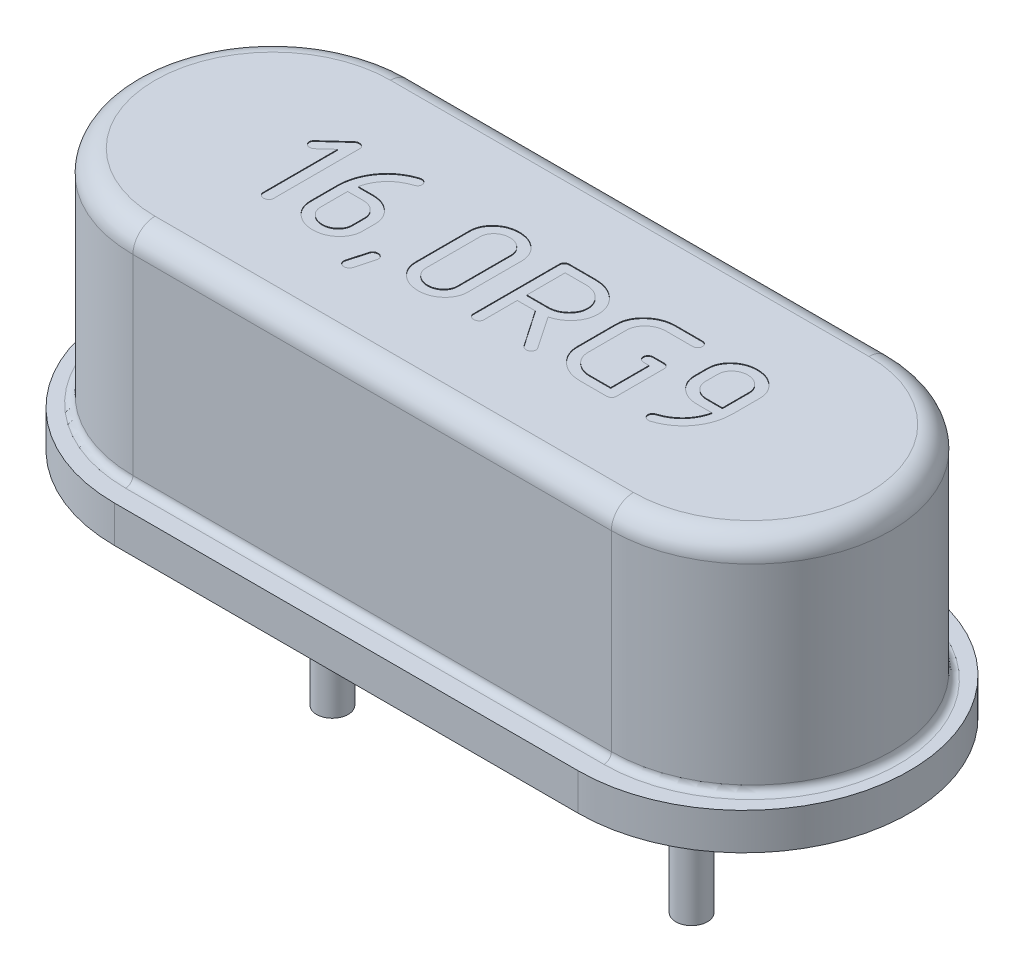
from build123d import *

# Parameters (mm, degrees)
BOSS_EXTRUDE1_START   = 0.05
BOSS_EXTRUDE1_DEPTH   = 0.5
BOSS_EXTRUDE2_DEPTH   = 3
SKETCH_3_R            = 0.645
CUT_EXTRUDE1_DEPTH    = 0.1
SKETCH_4_R            = 0.215
BOSS_EXTRUDE3_DEPTH   = 2.75
BOSS_EXTRUDE3_2_DEPTH = 2.75
CUT_EXTRUDE2_DEPTH    = 0.01
FILLET1_R             = 0.1
FILLET2_R             = 0.3


with BuildPart() as part:
    # Эскиз1 → Boss-Extrude1 (new body)
    with BuildSketch(Plane(origin=(0, 0, 0), x_dir=(1, 0, 0), z_dir=(0, 1, 0)).offset(BOSS_EXTRUDE1_START)):
        with BuildLine():
            Line((3.15, -2.25), (-3.15, -2.25))
            ThreePointArc((-3.15, -2.25), (-5.4, 0), (-3.15, 2.25))
            Line((-3.15, 2.25), (3.15, 2.25))
            ThreePointArc((3.15, 2.25), (5.4, 0), (3.15, -2.25))
        make_face()
    extrude(amount=BOSS_EXTRUDE1_DEPTH)

    # Эскиз2 → Boss-Extrude2 (add)
    with BuildSketch(Plane(origin=(0, 0.55, 0), x_dir=(1, 0, 0), z_dir=(0, 1, 0))):
        with BuildLine():
            Line((3.25, -1.9), (-3.25, -1.9))
            ThreePointArc((-3.25, -1.9), (-5.15, 0), (-3.25, 1.9))
            Line((-3.25, 1.9), (3.25, 1.9))
            ThreePointArc((3.25, 1.9), (5.15, 0), (3.25, -1.9))
        make_face()
    extrude(amount=BOSS_EXTRUDE2_DEPTH)

    # Эскиз3 → Cut-Extrude1 (cut)
    with BuildSketch(Plane.XZ.offset(-0.05)):
        with Locations(Location((2.44, 0, 0), (0, 0, 270))):
            Circle(SKETCH_3_R)
        with Locations(Location((-2.44, 0, 0), (0, 0, 90))):
            Circle(SKETCH_3_R)
    extrude(amount=-CUT_EXTRUDE1_DEPTH, mode=Mode.SUBTRACT)

    # Эскиз6 → Cut-Extrude2 (cut)
    # profile 1 of 7: a face of its own
    with BuildSketch(Plane(origin=(0, 3.55, 0), x_dir=(1, 0, 0), z_dir=(0, 1, 0))):
        with BuildLine():
            add(Edge.make_bspline(
                [(-2.725012297, 0.65), (-2.720192837, 0.649749273), (-2.710844879, 0.649262956), (-2.697498811, 0.645636223), (-2.685292044, 0.639758075), (-2.674610795, 0.631505185), (-2.665709738, 0.621597105), (-2.65863101, 0.610623967), (-2.654758447, 0.598132914), (-2.654277773, 0.589489396), (-2.654033448, 0.585095917)],
                knots=[0, 0, 0, 0, 1.080943862, 2.096628844, 3.081116141, 4.105220871, 5.104712942, 6.060880701, 7.01435038, 8, 8, 8, 8], degree=3))
            Line((-2.654033448, 0.585095917), (-2.654033448, -0.585095917))
            add(Edge.make_bspline(
                [(-2.654033448, -0.585095917), (-2.654259054, -0.58949647), (-2.654697685, -0.598052163), (-2.658795578, -0.610437613), (-2.665591859, -0.621560151), (-2.674626244, -0.631499893), (-2.685289436, -0.639746824), (-2.697587868, -0.645730006), (-2.711070628, -0.649108153), (-2.725329306, -0.650446062), (-2.739500918, -0.649151791), (-2.752842402, -0.645662614), (-2.765063152, -0.63975657), (-2.775691646, -0.631483038), (-2.784809162, -0.621655365), (-2.791167028, -0.610339272), (-2.795347744, -0.598064427), (-2.795772616, -0.589500635), (-2.795991146, -0.585095917)],
                knots=[0, 0, 0, 0, 0.985259516, 1.915572712, 2.891791621, 3.89088811, 4.914587517, 5.89868517, 6.93708688, 8.017602922, 9.098118965, 10.113401956, 11.097499609, 12.121199016, 13.120295505, 14.084427288, 15.014740484, 16, 16, 16, 16], degree=3))
            Line((-2.795991146, -0.585095917), (-2.795991146, 0.427791441))
            Line((-2.795991146, 0.427791441), (-2.959370389, 0.279439252))
            add(Edge.make_bspline(
                [(-2.959370389, 0.279439252), (-2.962997298, 0.276415595), (-2.970036901, 0.270546864), (-2.982303077, 0.264243218), (-2.995518977, 0.26074994), (-3.004645137, 0.260208899), (-3.009247418, 0.259936055)],
                knots=[0, 0, 0, 0, 1.031401964, 2.001886738, 2.992360711, 4, 4, 4, 4], degree=3))
            add(Edge.make_bspline(
                [(-3.009247418, 0.259936055), (-3.014069398, 0.260181894), (-3.023422245, 0.260658729), (-3.036826882, 0.264378467), (-3.04924131, 0.270071012), (-3.059921701, 0.278465947), (-3.069045574, 0.288277392), (-3.075401824, 0.299597614), (-3.07958295, 0.31187141), (-3.080007766, 0.320435346), (-3.080226267, 0.324840138)],
                knots=[0, 0, 0, 0, 1.079981633, 2.094762476, 3.099924327, 4.123117425, 5.121719773, 6.085374707, 7.015227781, 8, 8, 8, 8], degree=3))
            add(Edge.make_bspline(
                [(-3.080226267, 0.324840138), (-3.080020431, 0.329142687), (-3.079613788, 0.337642665), (-3.075122284, 0.349723637), (-3.068254525, 0.360914259), (-3.062035021, 0.367263214), (-3.058804722, 0.370560748)],
                knots=[0, 0, 0, 0, 0.989130722, 1.954094877, 2.937393591, 4, 4, 4, 4], degree=3))
            Line((-3.058804722, 0.370560748), (-2.774889326, 0.630496803))
            add(Edge.make_bspline(
                [(-2.774889326, 0.630496803), (-2.771269713, 0.633536288), (-2.764171229, 0.639497076), (-2.751790604, 0.645547361), (-2.73865332, 0.649239907), (-2.729619788, 0.649743265), (-2.725012297, 0.65)],
                knots=[0, 0, 0, 0, 1.03184141, 2.023561877, 2.991931391, 4, 4, 4, 4], degree=3))
        make_face()
    # profile 2 of 7: a face of its own
    with BuildSketch(Plane(origin=(0, 3.55, 0), x_dir=(1, 0, 0), z_dir=(0, 1, 0))):
        with BuildLine():
            add(Edge.make_bspline(
                [(-1.768396458, -0.594048205), (-1.777079781, -0.601715211), (-1.794280966, -0.616903129), (-1.822663664, -0.635842494), (-1.851946822, -0.652445201), (-1.882757767, -0.665978215), (-1.915184641, -0.676096022), (-1.948885073, -0.683492576), (-1.983871701, -0.687907133), (-2.019700004, -0.689564027), (-2.055527991, -0.687906826), (-2.090515535, -0.683493753), (-2.124212714, -0.676091741), (-2.15665145, -0.665993882), (-2.187504091, -0.652349798), (-2.217025792, -0.635964454), (-2.245353434, -0.616807432), (-2.27153259, -0.594441644), (-2.29573571, -0.570409813), (-2.317048688, -0.544842273), (-2.334630394, -0.517644461), (-2.349628795, -0.489555838), (-2.360669609, -0.459793377), (-2.369154984, -0.429142789), (-2.374024846, -0.397040181), (-2.374613728, -0.375266024), (-2.37491392, -0.364166257)],
                knots=[0, 0, 0, 0, 1.027880341, 2.036174347, 3.023722854, 4.015708177, 5.018699673, 6.036283645, 7.076643558, 8.147440813, 9.218238069, 10.258597981, 11.276181953, 12.27917345, 13.271158772, 14.266976344, 15.275270349, 16.30315069, 17.320646587, 18.302461157, 19.252969392, 20.193001166, 21.124845898, 22.066401843, 23.014313636, 24, 24, 24, 24], degree=3))
            Line((-2.37491392, -0.364166257), (-2.37491392, 0))
            add(Edge.make_bspline(
                [(-2.37491392, 0), (-2.374545053, 0.017918871), (-2.373814171, 0.053423804), (-2.367979402, 0.106049847), (-2.35799793, 0.157333198), (-2.344246311, 0.207374943), (-2.326511368, 0.256186943), (-2.305169193, 0.303816905), (-2.27968104, 0.350194827), (-2.250375449, 0.394873394), (-2.21809886, 0.437771122), (-2.181898961, 0.477216783), (-2.143036656, 0.51376185), (-2.100770855, 0.546698821), (-2.056079603, 0.576945454), (-2.008071093, 0.60347889), (-1.95714331, 0.627050651), (-1.921442226, 0.639728155), (-1.903320216, 0.646163305)],
                knots=[0, 0, 0, 0, 1.004229544, 1.989807487, 2.963381842, 3.930040632, 4.895665206, 5.871600899, 6.852769725, 7.858508388, 8.864513131, 9.858258314, 10.855713287, 11.851198595, 12.858550397, 13.877420399, 14.922570291, 16, 16, 16, 16], degree=3))
            add(Edge.make_bspline(
                [(-1.903320216, 0.646163305), (-1.899081065, 0.647282303), (-1.89069454, 0.649496071), (-1.882028068, 0.649833254), (-1.877742253, 0.65)],
                knots=[0, 0, 0, 0, 1.01094356, 2, 2, 2, 2], degree=3))
            add(Edge.make_bspline(
                [(-1.877742253, 0.65), (-1.872922793, 0.649749273), (-1.863574835, 0.649262956), (-1.850228767, 0.645636223), (-1.838021999, 0.639758075), (-1.827340751, 0.631505185), (-1.818439694, 0.621597105), (-1.811360966, 0.610623967), (-1.807488403, 0.598132914), (-1.807007729, 0.589489396), (-1.806763404, 0.585095917)],
                knots=[0, 0, 0, 0, 1.080943862, 2.096628844, 3.081116141, 4.105220871, 5.104712942, 6.060880701, 7.01435038, 8, 8, 8, 8], degree=3))
            add(Edge.make_bspline(
                [(-1.806763404, 0.585095917), (-1.807150156, 0.577909216), (-1.807887688, 0.564204259), (-1.818371915, 0.546128776), (-1.834005097, 0.531562961), (-1.847734034, 0.526437197), (-1.85504181, 0.523708805)],
                knots=[0, 0, 0, 0, 1.012219468, 1.930290753, 2.898314459, 4, 4, 4, 4], degree=3))
            add(Edge.make_bspline(
                [(-1.85504181, 0.523708805), (-1.878541217, 0.515150898), (-1.924656529, 0.498356834), (-1.988271567, 0.463161238), (-2.045995237, 0.421906755), (-2.096035904, 0.373031112), (-2.13903112, 0.31897774), (-2.174197798, 0.26020145), (-2.201614176, 0.19712356), (-2.21288287, 0.152595186), (-2.218568618, 0.13012789)],
                knots=[0, 0, 0, 0, 1.067365666, 2.094601819, 3.095831916, 4.091118831, 5.073440703, 6.039665875, 7.010891187, 8, 8, 8, 8], degree=3))
            Line((-2.218568618, 0.13012789), (-2.019699951, 0.13012789))
            add(Edge.make_bspline(
                [(-2.019699951, 0.13012789), (-2.007642975, 0.129806686), (-1.983871743, 0.129173409), (-1.94888496, 0.124576775), (-1.915185042, 0.11722687), (-1.882756303, 0.107098688), (-1.851952212, 0.093561674), (-1.822643464, 0.076985183), (-1.794358766, 0.057942331), (-1.768189018, 0.035559555), (-1.743983426, 0.011532226), (-1.722671, -0.014036457), (-1.705089442, -0.041234016), (-1.690089946, -0.06932256), (-1.679053338, -0.09908558), (-1.670523849, -0.129835676), (-1.66571818, -0.162055541), (-1.665112815, -0.183933184), (-1.664805706, -0.195031972)],
                knots=[0, 0, 0, 0, 1.08068204, 2.130645763, 3.157623296, 4.169873646, 5.171016222, 6.167681025, 7.185282833, 8.222651783, 9.249540426, 10.240418362, 11.199700964, 12.148410397, 13.088857209, 14.039104882, 15.00521453, 16, 16, 16, 16], degree=3))
            Line((-1.664805706, -0.195031972), (-1.664805706, -0.364166257))
            add(Edge.make_bspline(
                [(-1.664805706, -0.364166257), (-1.66510589, -0.375266033), (-1.665694755, -0.397040208), (-1.670564738, -0.429142687), (-1.67904966, -0.459793757), (-1.690092155, -0.489554431), (-1.70508422, -0.517649792), (-1.722690136, -0.544821857), (-1.743908523, -0.57048999), (-1.760137269, -0.586102588), (-1.768396458, -0.594048205)],
                knots=[0, 0, 0, 0, 1.024508938, 2.009755503, 2.988395887, 3.956942568, 4.933998749, 5.92194402, 6.942428669, 8, 8, 8, 8], degree=3))
        make_face()
        with BuildLine():
            add(Edge.make_bspline(
                [(-2.170609936, -0.501967536), (-2.159957967, -0.510771998), (-2.138944829, -0.528140559), (-2.101806299, -0.545548122), (-2.062085805, -0.556908067), (-2.02001078, -0.559906144), (-1.977885333, -0.556835688), (-1.938013965, -0.545752311), (-1.901239673, -0.527813087), (-1.868808534, -0.502946101), (-1.841283702, -0.473426417), (-1.821267661, -0.439648282), (-1.808804297, -0.40285439), (-1.807448756, -0.377158116), (-1.806763404, -0.364166257)],
                knots=[0, 0, 0, 0, 1.021602171, 2.015314498, 3.016735725, 4.071964365, 5.127193006, 6.13623326, 7.122842026, 8.144444197, 9.151841138, 10.098378379, 11.038553163, 12, 12, 12, 12], degree=3))
            Line((-1.806763404, -0.364166257), (-1.806763404, -0.195031972))
            add(Edge.make_bspline(
                [(-1.806763404, -0.195031972), (-1.807448577, -0.182039871), (-1.808803764, -0.156343119), (-1.821269746, -0.119552762), (-1.841275607, -0.08576088), (-1.868782824, -0.056358435), (-1.901092429, -0.031232832), (-1.937781201, -0.013276815), (-1.977659003, -0.00174638), (-2.005443992, -0.000592192), (-2.019699951, 0)],
                knots=[0, 0, 0, 0, 0.970580775, 1.919687408, 2.875216942, 3.892184356, 4.917139854, 5.923811547, 6.934746476, 8, 8, 8, 8], degree=3))
            Line((-2.019699951, 0), (-2.232956222, 0))
            Line((-2.232956222, 0), (-2.232956222, -0.364166257))
            add(Edge.make_bspline(
                [(-2.232956222, -0.364166257), (-2.23227414, -0.37716193), (-2.230925067, -0.402865747), (-2.218413907, -0.439603898), (-2.19862019, -0.473536305), (-2.180122428, -0.492312077), (-2.170609936, -0.501967536)],
                knots=[0, 0, 0, 0, 0.998844728, 1.975589973, 2.958945159, 4, 4, 4, 4], degree=3))
        make_face(mode=Mode.SUBTRACT)
    # profile 3 of 7: a face of its own
    with BuildSketch(Plane(origin=(0, 3.55, 0), x_dir=(1, 0, 0), z_dir=(0, 1, 0))):
        with BuildLine():
            add(Edge.make_bspline(
                [(-1.301278898, -0.51987211), (-1.296462135, -0.520134526), (-1.287016348, -0.520649128), (-1.273536632, -0.524171542), (-1.261230097, -0.530113724), (-1.250596995, -0.538388937), (-1.241489846, -0.548218981), (-1.235046543, -0.559613492), (-1.230989418, -0.572037809), (-1.230532367, -0.580695324), (-1.230300049, -0.585095917)],
                knots=[0, 0, 0, 0, 1.076707874, 2.111449841, 3.092079142, 4.112170624, 5.107745899, 6.068479697, 7.018212931, 8, 8, 8, 8], degree=3))
            add(Edge.make_bspline(
                [(-1.230300049, -0.585095917), (-1.230308945, -0.588089054), (-1.230324263, -0.593242686), (-1.23120833, -0.598315909), (-1.231578947, -0.600442696)],
                knots=[0, 0, 0, 0, 1.161563942, 2, 2, 2, 2], degree=3))
            Line((-1.231578947, -0.600442696), (-1.302557796, -0.860698475))
            add(Edge.make_bspline(
                [(-1.302557796, -0.860698475), (-1.305209897, -0.867377909), (-1.310704346, -0.881215925), (-1.32772872, -0.896754205), (-1.348580011, -0.908024153), (-1.364331997, -0.909296076), (-1.372257747, -0.909936055)],
                knots=[0, 0, 0, 0, 0.936021192, 1.939187544, 2.963084071, 4, 4, 4, 4], degree=3))
            add(Edge.make_bspline(
                [(-1.372257747, -0.909936055), (-1.377079727, -0.909690216), (-1.386432575, -0.909213381), (-1.399837212, -0.905493643), (-1.412251639, -0.899801099), (-1.422932031, -0.891406163), (-1.432055904, -0.881594718), (-1.438412153, -0.870274496), (-1.442593279, -0.858000701), (-1.443018095, -0.849436765), (-1.443236596, -0.845031972)],
                knots=[0, 0, 0, 0, 1.079981633, 2.094762476, 3.099924327, 4.123117425, 5.121719773, 6.085374707, 7.015227781, 8, 8, 8, 8], degree=3))
            add(Edge.make_bspline(
                [(-1.443236596, -0.845031972), (-1.443276805, -0.841924208), (-1.443345277, -0.836632011), (-1.442136793, -0.831488521), (-1.441637973, -0.82936547)],
                knots=[0, 0, 0, 0, 1.174470349, 2, 2, 2, 2], degree=3))
            Line((-1.441637973, -0.82936547), (-1.370659124, -0.569429415))
            add(Edge.make_bspline(
                [(-1.370659124, -0.569429415), (-1.368133861, -0.562738125), (-1.362884647, -0.548829079), (-1.345647808, -0.533339798), (-1.324899213, -0.521819064), (-1.309101948, -0.520516941), (-1.301278898, -0.51987211)],
                knots=[0, 0, 0, 0, 0.930230329, 1.933650631, 2.976711917, 4, 4, 4, 4], degree=3))
        make_face()
    # profile 4 of 7: a face of its own
    with BuildSketch(Plane(origin=(0, 3.55, 0), x_dir=(1, 0, 0), z_dir=(0, 1, 0))):
        with BuildLine():
            add(Edge.make_bspline(
                [(-0.838957206, 0.594048205), (-0.830271562, 0.601711044), (-0.81306578, 0.616890707), (-0.784639303, 0.635942624), (-0.755143575, 0.652355589), (-0.724284014, 0.665992314), (-0.691847156, 0.67609217), (-0.658149461, 0.683493635), (-0.623162062, 0.687906857), (-0.587334026, 0.689564027), (-0.551505772, 0.687907103), (-0.516519001, 0.683492693), (-0.482819079, 0.676095599), (-0.450390341, 0.665979764), (-0.41958625, 0.652439496), (-0.390277503, 0.635863874), (-0.361992804, 0.616820784), (-0.335823056, 0.594438074), (-0.311617464, 0.570410727), (-0.290305038, 0.544842049), (-0.27272348, 0.517644489), (-0.257723984, 0.489555945), (-0.246687376, 0.459792924), (-0.238157888, 0.429042829), (-0.233352219, 0.396822963), (-0.232746853, 0.374945321), (-0.232439744, 0.363846532)],
                knots=[0, 0, 0, 0, 1.02747958, 2.03538046, 3.030809771, 4.022408327, 5.025008766, 6.042195991, 7.082150276, 8.152530037, 9.222909798, 10.262864083, 11.280051308, 12.282651747, 13.274250303, 14.261413773, 15.269314654, 16.296794233, 17.313893417, 18.295325187, 19.245462826, 20.185128091, 21.116609504, 22.057798345, 23.014697947, 24, 24, 24, 24], degree=3))
            Line((-0.232439744, 0.363846532), (-0.232439744, -0.364166257))
            add(Edge.make_bspline(
                [(-0.232439744, -0.364166257), (-0.232739937, -0.375266024), (-0.233328818, -0.397040181), (-0.238198681, -0.429142788), (-0.246684053, -0.459793381), (-0.257724879, -0.489555822), (-0.272723237, -0.517644522), (-0.290305106, -0.54484204), (-0.311617445, -0.57041073), (-0.335823061, -0.594438073), (-0.361992803, -0.616820784), (-0.390277503, -0.635863874), (-0.41958625, -0.652439496), (-0.450390341, -0.665979764), (-0.482819079, -0.676095599), (-0.516519001, -0.683492693), (-0.55150577, -0.687907101), (-0.587334034, -0.689564036), (-0.623162031, -0.687906824), (-0.658149573, -0.683493753), (-0.691846753, -0.676091741), (-0.724285488, -0.665993882), (-0.755138129, -0.652349798), (-0.78465983, -0.635964454), (-0.812987472, -0.616807432), (-0.839166628, -0.594441644), (-0.863369748, -0.570409813), (-0.884682727, -0.544842273), (-0.902264432, -0.517644461), (-0.917262833, -0.489555838), (-0.928303647, -0.459793377), (-0.936789023, -0.429142789), (-0.941658885, -0.397040181), (-0.942247766, -0.375266024), (-0.942547959, -0.364166257)],
                knots=[0, 0, 0, 0, 0.995113531, 1.952091213, 2.90265226, 3.843409214, 4.792431512, 5.752030468, 6.743235176, 7.770462468, 8.808173522, 9.826110916, 10.823104401, 11.824577134, 12.837161305, 13.864477515, 14.914787496, 15.995825925, 17.076864354, 18.127174335, 19.154490545, 20.167074716, 21.168547449, 22.173889084, 23.191826478, 24.229537532, 25.256764824, 26.247969532, 27.207568488, 28.156590786, 29.09734774, 30.047908787, 31.004886469, 32, 32, 32, 32], degree=3))
            Line((-0.942547959, -0.364166257), (-0.942547959, 0.363846532))
            add(Edge.make_bspline(
                [(-0.942547959, 0.363846532), (-0.942240858, 0.37494533), (-0.941635509, 0.39682299), (-0.936829718, 0.429042726), (-0.928300681, 0.4597933), (-0.917262405, 0.489554554), (-0.902269201, 0.517649758), (-0.884663597, 0.544821867), (-0.863445124, 0.570489987), (-0.847216389, 0.586102587), (-0.838957206, 0.594048205)],
                knots=[0, 0, 0, 0, 1.023264426, 2.017032092, 2.994483682, 3.961853831, 4.937723143, 5.924468317, 6.943713343, 8, 8, 8, 8], degree=3))
        make_face()
        with BuildLine():
            add(Edge.make_bspline(
                [(-0.437063453, 0.501647811), (-0.447737752, 0.510405895), (-0.4687574, 0.527652164), (-0.505611326, 0.545771302), (-0.545514851, 0.556823812), (-0.587653558, 0.559920657), (-0.629690266, 0.556863306), (-0.669589115, 0.545690465), (-0.706274897, 0.527513289), (-0.738883404, 0.502746459), (-0.766048563, 0.472989538), (-0.786101022, 0.439342766), (-0.798545524, 0.402531029), (-0.799903618, 0.376837171), (-0.800590261, 0.363846532)],
                knots=[0, 0, 0, 0, 1.021459491, 2.011440767, 3.020340095, 4.075421359, 5.130502623, 6.131783988, 7.128842827, 8.150302318, 9.152238921, 10.098643965, 11.038687442, 12, 12, 12, 12], degree=3))
            Line((-0.800590261, 0.363846532), (-0.800590261, -0.364166257))
            add(Edge.make_bspline(
                [(-0.800590261, -0.364166257), (-0.79990369, -0.377157041), (-0.798545739, -0.402851189), (-0.786100183, -0.43966079), (-0.766051813, -0.473315854), (-0.738870373, -0.50303975), (-0.706361545, -0.527903875), (-0.669498284, -0.545611231), (-0.62970333, -0.556890083), (-0.587649348, -0.559911076), (-0.545518216, -0.55683443), (-0.505648299, -0.545752633), (-0.46887363, -0.527812998), (-0.436442594, -0.502946125), (-0.408917735, -0.473426411), (-0.388901701, -0.439648283), (-0.376438335, -0.402854389), (-0.375082794, -0.377158116), (-0.374397442, -0.364166257)],
                knots=[0, 0, 0, 0, 0.970531288, 1.919589529, 2.875070344, 3.88661525, 4.917870263, 5.920971909, 6.931855293, 7.997054504, 9.062253714, 10.080828116, 11.076759081, 12.108014095, 13.124929656, 14.080410471, 15.029468712, 16, 16, 16, 16], degree=3))
            Line((-0.374397442, -0.364166257), (-0.374397442, 0.363846532))
            add(Edge.make_bspline(
                [(-0.374397442, 0.363846532), (-0.375078634, 0.376843024), (-0.376425947, 0.402548459), (-0.388950112, 0.439274652), (-0.408729711, 0.473316056), (-0.427424772, 0.492009806), (-0.437063453, 0.501647811)],
                knots=[0, 0, 0, 0, 0.997466395, 1.972863803, 2.954862031, 4, 4, 4, 4], degree=3))
        make_face(mode=Mode.SUBTRACT)
    # profile 5 of 7: a face of its own
    with BuildSketch(Plane(origin=(0, 3.55, 0), x_dir=(1, 0, 0), z_dir=(0, 1, 0))):
        with BuildLine():
            Line((0.131087063, 0.65), (0.486301033, 0.65))
            add(Edge.make_bspline(
                [(0.486301033, 0.65), (0.500700555, 0.649576973), (0.529162898, 0.648740811), (0.571068389, 0.643750416), (0.611265329, 0.634631603), (0.649926311, 0.622286505), (0.686736539, 0.605615102), (0.722470108, 0.586355542), (0.75610654, 0.562683853), (0.787831766, 0.536003697), (0.8169696, 0.507028947), (0.8425118, 0.476108145), (0.863972013, 0.443707814), (0.881880425, 0.40983422), (0.895459577, 0.374356546), (0.905608237, 0.337564666), (0.911409706, 0.299234879), (0.912128753, 0.27317039), (0.912493851, 0.259936055)],
                knots=[0, 0, 0, 0, 1.076669153, 2.128162837, 3.148775729, 4.154097676, 5.156415777, 6.165550729, 7.18445173, 8.224991266, 9.261618985, 10.252183112, 11.217857894, 12.162262626, 13.110691828, 14.051965761, 15.01087884, 16, 16, 16, 16], degree=3))
            add(Edge.make_bspline(
                [(0.912493851, 0.259936055), (0.912278888, 0.249051064), (0.911851567, 0.227412981), (0.907498591, 0.195548629), (0.900845727, 0.164482692), (0.891166357, 0.134454257), (0.878977582, 0.105255611), (0.864232287, 0.076938262), (0.846542065, 0.049664132), (0.826143827, 0.023722107), (0.803826016, -0.000871963), (0.779890427, -0.023537478), (0.754402312, -0.044252634), (0.727305967, -0.062686924), (0.698764771, -0.079038574), (0.668780879, -0.093289446), (0.637148938, -0.105022454), (0.615299965, -0.111296681), (0.60427939, -0.114461387)],
                knots=[0, 0, 0, 0, 0.999751351, 1.987388152, 2.949840543, 3.916221633, 4.882056646, 5.854572294, 6.846134746, 7.864894479, 8.884077822, 9.895561618, 10.891323273, 11.899149404, 12.903782056, 13.911417815, 14.946523579, 16, 16, 16, 16], degree=3))
            Line((0.60427939, -0.114461387), (0.900983768, -0.551205116))
            add(Edge.make_bspline(
                [(0.900983768, -0.551205116), (0.904338296, -0.556695673), (0.91072463, -0.567148571), (0.911924319, -0.579318463), (0.912493851, -0.585095917)],
                knots=[0, 0, 0, 0, 1.050533193, 2, 2, 2, 2], degree=3))
            add(Edge.make_bspline(
                [(0.912493851, -0.585095917), (0.912268248, -0.58949649), (0.911829622, -0.598052224), (0.907731696, -0.61043738), (0.900935543, -0.621561081), (0.89190066, -0.631496298), (0.881239354, -0.639760373), (0.869027378, -0.6456356), (0.855682723, -0.649263125), (0.846334565, -0.649749331), (0.841515002, -0.65)],
                knots=[0, 0, 0, 0, 0.985939296, 1.916894362, 2.893786813, 3.893572629, 4.917978338, 5.902754969, 6.918738455, 8, 8, 8, 8], degree=3))
            add(Edge.make_bspline(
                [(0.841515002, -0.65), (0.835373061, -0.649705618), (0.823499241, -0.649136509), (0.80711644, -0.642598388), (0.792563888, -0.63277712), (0.785432535, -0.623492189), (0.781726513, -0.618666995)],
                knots=[0, 0, 0, 0, 1.042271553, 2.014956347, 2.968412152, 4, 4, 4, 4], degree=3))
            Line((0.781726513, -0.618666995), (0.446655189, -0.13012789))
            Line((0.446655189, -0.13012789), (0.202065912, -0.13012789))
            Line((0.202065912, -0.13012789), (0.202065912, -0.585095917))
            add(Edge.make_bspline(
                [(0.202065912, -0.585095917), (0.20184738, -0.589500626), (0.201422503, -0.598064401), (0.197241822, -0.610339369), (0.190883822, -0.621654979), (0.18176683, -0.631484554), (0.171136343, -0.639750858), (0.158829462, -0.645728636), (0.145348494, -0.649109532), (0.131091587, -0.650441839), (0.116911105, -0.649166833), (0.103507891, -0.645586092), (0.091093092, -0.639857278), (0.080412801, -0.631472151), (0.071288902, -0.621658142), (0.064932659, -0.610338572), (0.060751531, -0.598064611), (0.060326715, -0.589500698), (0.060108214, -0.585095917)],
                knots=[0, 0, 0, 0, 0.984676436, 1.91443907, 2.878000276, 3.876505497, 4.899599075, 5.883114336, 6.920901516, 8.000778106, 9.080654696, 10.095336839, 11.100400925, 12.123494503, 13.121999724, 14.08556093, 15.015323564, 16, 16, 16, 16], degree=3))
            Line((0.060108214, -0.585095917), (0.060108214, 0.585095917))
            add(Edge.make_bspline(
                [(0.060108214, 0.585095917), (0.060345372, 0.589493786), (0.060811943, 0.598145941), (0.064770759, 0.610520753), (0.071407334, 0.621697257), (0.080397203, 0.631478394), (0.091097302, 0.639862846), (0.103506496, 0.645558174), (0.116912534, 0.649277167), (0.126265184, 0.649754107), (0.131087063, 0.65)],
                knots=[0, 0, 0, 0, 0.984515408, 1.936887906, 2.879615877, 3.877957807, 4.900884075, 5.905783799, 6.920300007, 8, 8, 8, 8], degree=3))
        make_face()
        with BuildLine():
            Line((0.202065912, 0.51987211), (0.202065912, 0))
            Line((0.202065912, 0), (0.486301033, 0))
            add(Edge.make_bspline(
                [(0.486301033, 0), (0.495794681, 0.000275909), (0.514633088, 0.0008234), (0.542396444, 0.004266726), (0.569091611, 0.010507418), (0.594803094, 0.018634645), (0.619248627, 0.029850394), (0.643014059, 0.042740685), (0.665397922, 0.058682473), (0.686653335, 0.076339717), (0.706120255, 0.09582658), (0.723349141, 0.116415176), (0.737874596, 0.138081733), (0.749914144, 0.160492044), (0.758717367, 0.184126952), (0.765684868, 0.208447455), (0.769366839, 0.233917174), (0.770647057, 0.259936125), (0.769366496, 0.285954658), (0.765686191, 0.311425593), (0.758712494, 0.335741736), (0.749932274, 0.35939279), (0.73776301, 0.38181992), (0.723562906, 0.40372426), (0.705989821, 0.424045303), (0.686673316, 0.443548388), (0.665392668, 0.461185431), (0.643015439, 0.47713253), (0.619248265, 0.490021427), (0.594803191, 0.501237543), (0.569091584, 0.509364671), (0.542396451, 0.51560539), (0.514633086, 0.519048709), (0.49579468, 0.519596201), (0.486301033, 0.51987211)],
                knots=[0, 0, 0, 0, 1.066624057, 2.116520235, 3.135937978, 4.143048415, 5.139858588, 6.152716893, 7.17571389, 8.221163509, 9.253991543, 10.265717055, 11.232006113, 12.179949322, 13.116023753, 14.060027283, 15.016700544, 15.999609139, 16.982517735, 17.939190995, 18.883194526, 19.819268957, 20.767212166, 21.74346285, 22.746008457, 23.778836491, 24.82428611, 25.847283107, 26.860141412, 27.856951585, 28.864062022, 29.883479765, 30.933375943, 32, 32, 32, 32], degree=3))
            Line((0.486301033, 0.51987211), (0.202065912, 0.51987211))
        make_face(mode=Mode.SUBTRACT)
    # profile 6 of 7: a face of its own
    with BuildSketch(Plane(origin=(0, 3.55, 0), x_dir=(1, 0, 0), z_dir=(0, 1, 0))):
        with BuildLine():
            Line((1.577201181, 0.65), (1.932095425, 0.65))
            add(Edge.make_bspline(
                [(1.932095425, 0.65), (1.93691496, 0.649749326), (1.946263065, 0.649263113), (1.9596081, 0.645635645), (1.971818674, 0.639760208), (1.98248535, 0.631496938), (1.991500633, 0.621558781), (1.998420647, 0.610358461), (2.002259723, 0.597821065), (2.003478199, 0.584779779), (2.002308688, 0.571818987), (1.998340057, 0.559434978), (1.991508135, 0.54831096), (1.982483262, 0.538375832), (1.971819214, 0.530111732), (1.959607953, 0.524236511), (1.946263105, 0.520608985), (1.936914974, 0.520122779), (1.932095425, 0.51987211)],
                knots=[0, 0, 0, 0, 1.079723288, 2.094261385, 3.077637023, 4.100585361, 5.098948831, 6.074451507, 7.026844552, 8.011381202, 8.995917851, 9.925548493, 10.901051169, 11.899414639, 12.922362977, 13.905738615, 14.920276712, 16, 16, 16, 16], degree=3))
            Line((1.932095425, 0.51987211), (1.577201181, 0.51987211))
            add(Edge.make_bspline(
                [(1.577201181, 0.51987211), (1.567599927, 0.519606091), (1.548758519, 0.519084058), (1.521005456, 0.515567055), (1.494404699, 0.509380195), (1.468626749, 0.501160567), (1.444001416, 0.490109811), (1.420172257, 0.47712108), (1.397787723, 0.461188912), (1.376512256, 0.443546223), (1.357182713, 0.424050345), (1.339654823, 0.403706968), (1.325320476, 0.381922965), (1.313728814, 0.359225349), (1.304347969, 0.335831041), (1.297559385, 0.311411508), (1.293695197, 0.28595833), (1.293211287, 0.268688014), (1.29296606, 0.259936055)],
                knots=[0, 0, 0, 0, 1.077895139, 2.11525101, 3.134017138, 4.140483829, 5.147590381, 6.159801264, 7.18214436, 8.226925726, 9.259093574, 10.260998352, 11.236625015, 12.178430464, 13.118257807, 14.061657928, 15.017719682, 16, 16, 16, 16], degree=3))
            Line((1.29296606, 0.259936055), (1.29296606, -0.259936055))
            add(Edge.make_bspline(
                [(1.29296606, -0.259936055), (1.293210859, -0.268688255), (1.293693922, -0.285959045), (1.297564297, -0.311408752), (1.304329832, -0.335841218), (1.313832041, -0.359275522), (1.325112077, -0.382156391), (1.339881713, -0.403752603), (1.357048421, -0.424372664), (1.376534094, -0.443847448), (1.397778941, -0.461520483), (1.420185557, -0.477412438), (1.443920044, -0.490509599), (1.468709713, -0.501076332), (1.494393178, -0.509406606), (1.521008603, -0.515559841), (1.54875769, -0.519085958), (1.567599647, -0.519606733), (1.577201181, -0.51987211)],
                knots=[0, 0, 0, 0, 0.981967228, 1.937724248, 2.880823672, 3.820351456, 4.77250919, 5.737872798, 6.748629343, 7.780468201, 8.824916555, 9.846933791, 10.858822044, 11.860835902, 12.866981793, 13.885423202, 14.922448428, 16, 16, 16, 16], degree=3))
            Line((1.577201181, -0.51987211), (1.861116576, -0.51987211))
            Line((1.861116576, -0.51987211), (1.861116576, 0))
            Line((1.861116576, 0), (1.790137727, 0))
            add(Edge.make_bspline(
                [(1.790137727, 0), (1.785315761, 0.000245839), (1.77596294, 0.000722674), (1.762558113, 0.004442414), (1.750144395, 0.010134951), (1.739461332, 0.018529911), (1.730347124, 0.028341268), (1.72395661, 0.039661804), (1.719900502, 0.051934454), (1.718767267, 0.064907668), (1.71994923, 0.077961477), (1.723878719, 0.090385937), (1.730354845, 0.101784111), (1.739459174, 0.111598681), (1.750144968, 0.119992752), (1.762557961, 0.125685526), (1.775962982, 0.129405202), (1.785315775, 0.129882047), (1.790137727, 0.13012789)],
                knots=[0, 0, 0, 0, 1.078447013, 2.091785885, 3.095519432, 4.117258605, 5.11444197, 6.076727581, 7.005259363, 7.988632251, 8.97200514, 9.923272419, 10.88555803, 11.882741395, 12.904480568, 13.908214115, 14.921552987, 16, 16, 16, 16], degree=3))
            Line((1.790137727, 0.13012789), (1.932095425, 0.13012789))
            add(Edge.make_bspline(
                [(1.932095425, 0.13012789), (1.936914975, 0.129877216), (1.946263106, 0.129391003), (1.959607947, 0.125763533), (1.971819238, 0.119888103), (1.982483168, 0.111624808), (1.991508474, 0.10168674), (1.998392393, 0.0904861), (2.002363936, 0.07794988), (2.00283489, 0.069300527), (2.003074274, 0.064904083)],
                knots=[0, 0, 0, 0, 1.078189402, 2.091286216, 3.073264843, 4.09475995, 5.091705116, 6.065821964, 7.016862012, 8, 8, 8, 8], degree=3))
            Line((2.003074274, 0.064904083), (2.003074274, -0.585095917))
            add(Edge.make_bspline(
                [(2.003074274, -0.585095917), (2.002848671, -0.58949649), (2.002410045, -0.598052224), (1.998312119, -0.61043738), (1.991515966, -0.621561081), (1.982481083, -0.631496298), (1.971819777, -0.639760373), (1.959607801, -0.6456356), (1.946263146, -0.649263125), (1.936914988, -0.649749331), (1.932095425, -0.65)],
                knots=[0, 0, 0, 0, 0.985939296, 1.916894362, 2.893786813, 3.893572629, 4.917978338, 5.902754969, 6.918738455, 8, 8, 8, 8], degree=3))
            Line((1.932095425, -0.65), (1.577201181, -0.65))
            add(Edge.make_bspline(
                [(1.577201181, -0.65), (1.562799267, -0.649588364), (1.534437979, -0.648777741), (1.49256781, -0.643638012), (1.452248689, -0.634818829), (1.413736466, -0.621766581), (1.376721445, -0.605828171), (1.341277762, -0.586120687), (1.307414054, -0.562817263), (1.275684687, -0.535982446), (1.246524865, -0.507036399), (1.221006822, -0.476099095), (1.199421524, -0.443657073), (1.181789307, -0.409650521), (1.167960383, -0.374284024), (1.157909155, -0.337558308), (1.152088543, -0.29923654), (1.151372125, -0.273170949), (1.151008362, -0.259936055)],
                knots=[0, 0, 0, 0, 1.076778695, 2.120470311, 3.148964103, 4.156879703, 5.156095987, 6.158357702, 7.183914921, 8.224560323, 9.26129351, 10.251958418, 11.217731449, 12.169297997, 13.110397866, 14.051767565, 15.010778206, 16, 16, 16, 16], degree=3))
            Line((1.151008362, -0.259936055), (1.151008362, 0.259936055))
            add(Edge.make_bspline(
                [(1.151008362, 0.259936055), (1.15137346, 0.27317039), (1.152092506, 0.29923488), (1.157893981, 0.337564661), (1.168042622, 0.374356568), (1.181621842, 0.409834139), (1.199529999, 0.443708118), (1.220991191, 0.47610697), (1.246529571, 0.507033544), (1.275682396, 0.535985639), (1.307418375, 0.562807467), (1.341263134, 0.586155766), (1.376811918, 0.60572149), (1.413587575, 0.622262373), (1.452328301, 0.634692253), (1.492554961, 0.643674565), (1.53444133, 0.648768207), (1.562800395, 0.649585153), (1.577201181, 0.65)],
                knots=[0, 0, 0, 0, 0.989155489, 1.948101848, 2.88940845, 3.837870569, 4.782308078, 5.748016375, 6.738614881, 7.775278578, 8.815854227, 9.841342705, 10.843537241, 11.845890128, 12.851246966, 13.87967182, 14.923293479, 16, 16, 16, 16], degree=3))
        make_face()
    # profile 7 of 7: a face of its own
    with BuildSketch(Plane(origin=(0, 3.55, 0), x_dir=(1, 0, 0), z_dir=(0, 1, 0))):
        with BuildLine():
            add(Edge.make_bspline(
                [(2.394097393, 0.594048205), (2.402783037, 0.601711044), (2.419988819, 0.616890707), (2.448415296, 0.635942624), (2.477911025, 0.652355589), (2.508770585, 0.665992314), (2.541207444, 0.67609217), (2.574905138, 0.683493635), (2.609892537, 0.687906857), (2.645720573, 0.689564027), (2.681548827, 0.687907103), (2.716535599, 0.683492693), (2.75023552, 0.676095599), (2.782664258, 0.665979764), (2.813468349, 0.652439496), (2.842777096, 0.635863874), (2.871061795, 0.616820784), (2.897231543, 0.594438074), (2.921437135, 0.570410727), (2.942749561, 0.544842049), (2.960331119, 0.517644489), (2.975330615, 0.489555945), (2.986367223, 0.459792924), (2.994896711, 0.429042829), (2.99970238, 0.396822963), (3.000307746, 0.374945321), (3.000614855, 0.363846532)],
                knots=[0, 0, 0, 0, 1.02747958, 2.03538046, 3.030809771, 4.022408327, 5.025008766, 6.042195991, 7.082150276, 8.152530037, 9.222909798, 10.262864083, 11.280051308, 12.282651747, 13.274250303, 14.261413773, 15.269314654, 16.296794233, 17.313893417, 18.295325187, 19.245462826, 20.185128091, 21.116609504, 22.057798345, 23.014697947, 24, 24, 24, 24], degree=3))
            Line((3.000614855, 0.363846532), (3.000614855, 0))
            add(Edge.make_bspline(
                [(3.000614855, 0), (3.000245988, -0.017918871), (2.999515106, -0.053423804), (2.993680336, -0.106049846), (2.98369887, -0.157333203), (2.969947227, -0.207374922), (2.952212374, -0.256187019), (2.930869859, -0.303816619), (2.905382992, -0.350195913), (2.876072479, -0.394869229), (2.843814287, -0.437786579), (2.807599179, -0.477102564), (2.769052164, -0.513869691), (2.726776242, -0.546682517), (2.682104421, -0.576949895), (2.634090607, -0.603477667), (2.583164269, -0.627050971), (2.547462986, -0.639728263), (2.529340876, -0.646163305)],
                knots=[0, 0, 0, 0, 1.004503044, 1.990349407, 2.964188914, 3.931110971, 4.896998531, 5.873200019, 6.854636064, 7.860648638, 8.866927365, 9.860943193, 10.854312249, 11.850068676, 12.857694829, 13.876842318, 14.922276855, 16, 16, 16, 16], degree=3))
            add(Edge.make_bspline(
                [(2.529340876, -0.646163305), (2.525101724, -0.647282303), (2.516715199, -0.649496071), (2.508048727, -0.649833254), (2.503762912, -0.65)],
                knots=[0, 0, 0, 0, 1.01094356, 2, 2, 2, 2], degree=3))
            add(Edge.make_bspline(
                [(2.503762912, -0.65), (2.498943879, -0.649742344), (2.489493641, -0.649237075), (2.47595231, -0.645622977), (2.463450828, -0.639859063), (2.452768501, -0.631471682), (2.443645134, -0.621658262), (2.437288756, -0.610338542), (2.433107662, -0.598064619), (2.432682842, -0.5895007), (2.432464338, -0.585095917)],
                knots=[0, 0, 0, 0, 1.076871186, 2.111770102, 3.114036995, 4.134283202, 5.130009484, 6.090889004, 7.018064016, 8, 8, 8, 8], degree=3))
            add(Edge.make_bspline(
                [(2.432464338, -0.585095917), (2.433024634, -0.577940022), (2.434088053, -0.564358433), (2.44389894, -0.545921006), (2.460172467, -0.532036011), (2.473808384, -0.526809139), (2.481062469, -0.524028529)],
                knots=[0, 0, 0, 0, 1.01535909, 1.927108893, 2.897255886, 4, 4, 4, 4], degree=3))
            add(Edge.make_bspline(
                [(2.481062469, -0.524028529), (2.504574003, -0.515494176), (2.550761327, -0.498728834), (2.614168848, -0.463205269), (2.671739365, -0.421820496), (2.72171997, -0.373026501), (2.764873329, -0.318948922), (2.799643669, -0.259923285), (2.8277987, -0.197136572), (2.838953947, -0.152617649), (2.844589277, -0.13012789)],
                knots=[0, 0, 0, 0, 1.067360209, 2.096779833, 3.094320486, 4.089602313, 5.071919162, 6.042049607, 7.010896244, 8, 8, 8, 8], degree=3))
            Line((2.844589277, -0.13012789), (2.64572061, -0.13012789))
            add(Edge.make_bspline(
                [(2.64572061, -0.13012789), (2.633663686, -0.129806593), (2.609892556, -0.129173132), (2.57490503, -0.124577835), (2.541207844, -0.117223013), (2.508769117, -0.107112803), (2.477916448, -0.093471993), (2.448394852, -0.077085721), (2.420066812, -0.057929135), (2.393889168, -0.035562533), (2.369680502, -0.011533464), (2.348387264, 0.014043849), (2.33068333, 0.041286156), (2.315957051, 0.069504923), (2.304671728, 0.099158526), (2.296240082, 0.129841999), (2.291415131, 0.162053894), (2.290812408, 0.183932629), (2.29050664, 0.195031972)],
                knots=[0, 0, 0, 0, 1.080148772, 2.129594385, 3.15606515, 4.167816, 5.168464557, 6.172978831, 7.190078498, 8.226935552, 9.253317473, 10.243706454, 11.202515694, 12.159230214, 13.090293728, 14.040072496, 15.005705412, 16, 16, 16, 16], degree=3))
            Line((2.29050664, 0.195031972), (2.29050664, 0.363846532))
            add(Edge.make_bspline(
                [(2.29050664, 0.363846532), (2.290813741, 0.37494533), (2.29141909, 0.39682299), (2.296224881, 0.429042726), (2.304753918, 0.4597933), (2.315792195, 0.489554554), (2.330785398, 0.517649758), (2.348391003, 0.544821867), (2.369609475, 0.570489987), (2.38583821, 0.586102587), (2.394097393, 0.594048205)],
                knots=[0, 0, 0, 0, 1.023264426, 2.017032092, 2.994483682, 3.961853831, 4.937723143, 5.924468317, 6.943713343, 8, 8, 8, 8], degree=3))
        make_face()
        with BuildLine():
            add(Edge.make_bspline(
                [(2.795991146, 0.501647811), (2.785316848, 0.510405895), (2.764297199, 0.527652164), (2.727443273, 0.545771302), (2.687539748, 0.556823812), (2.645401041, 0.559920657), (2.603364333, 0.556863306), (2.563465484, 0.545690465), (2.526779702, 0.527513289), (2.494171195, 0.502746459), (2.467006036, 0.472989538), (2.446953577, 0.439342766), (2.434509075, 0.402531029), (2.433150981, 0.376837171), (2.432464338, 0.363846532)],
                knots=[0, 0, 0, 0, 1.021459491, 2.011440767, 3.020340095, 4.075421359, 5.130502623, 6.131783988, 7.128842827, 8.150302318, 9.152238921, 10.098643965, 11.038687442, 12, 12, 12, 12], degree=3))
            Line((2.432464338, 0.363846532), (2.432464338, 0.195031972))
            add(Edge.make_bspline(
                [(2.432464338, 0.195031972), (2.433150984, 0.182041316), (2.434509082, 0.156347421), (2.446953549, 0.119535952), (2.467006147, 0.085888137), (2.494170752, 0.056135373), (2.526781373, 0.03135268), (2.563551933, 0.013187921), (2.603590659, 0.00179258), (2.631469363, 0.000606374), (2.64572061, 0)],
                knots=[0, 0, 0, 0, 0.969529734, 1.917608581, 2.872103375, 3.882604402, 4.912795197, 5.918376767, 6.935900037, 8, 8, 8, 8], degree=3))
            Line((2.64572061, 0), (2.858657157, 0))
            Line((2.858657157, 0), (2.858657157, 0.363846532))
            add(Edge.make_bspline(
                [(2.858657157, 0.363846532), (2.857975965, 0.376843024), (2.856628652, 0.402548459), (2.844104487, 0.439274652), (2.824324888, 0.473316056), (2.805629827, 0.492009806), (2.795991146, 0.501647811)],
                knots=[0, 0, 0, 0, 0.997466395, 1.972863803, 2.954862031, 4, 4, 4, 4], degree=3))
        make_face(mode=Mode.SUBTRACT)
    extrude(amount=-CUT_EXTRUDE2_DEPTH, mode=Mode.SUBTRACT)

    # Fillet1
    fillet1_edges = [part.edges().sort_by_distance(p)[0] for p in [
        (5.15, 0.55, 0),
        (0, 0.55, -1.9),
        (-5.15, 0.55, 0),
        (0, 0.55, 1.9),
    ]]
    fillet(fillet1_edges, radius=FILLET1_R)

    # Fillet2
    fillet2_edges = [part.edges().sort_by_distance(p)[0] for p in [
        (5.15, 3.55, 0),
        (0, 3.55, -1.9),
        (-5.15, 3.55, 0),
        (0, 3.55, 1.9),
    ]]
    fillet(fillet2_edges, radius=FILLET2_R)


with BuildPart() as body_2:
    # Эскиз4 → Boss-Extrude3 (new body)
    with BuildSketch(Plane.XZ.offset(-0.15)):
        with Locations(Location((2.44, 0, 0), (0, 0, 90))):
            Circle(SKETCH_4_R)
    extrude(amount=BOSS_EXTRUDE3_DEPTH)


with BuildPart() as body_3:
    # Эскиз4 → Boss-Extrude3 2 (new body)
    with BuildSketch(Plane.XZ.offset(-0.15)):
        with Locations(Location((-2.44, 0, 0), (0, 0, 90))):
            Circle(SKETCH_4_R)
    extrude(amount=BOSS_EXTRUDE3_2_DEPTH)


solid = Compound([part.part, body_2.part, body_3.part])
